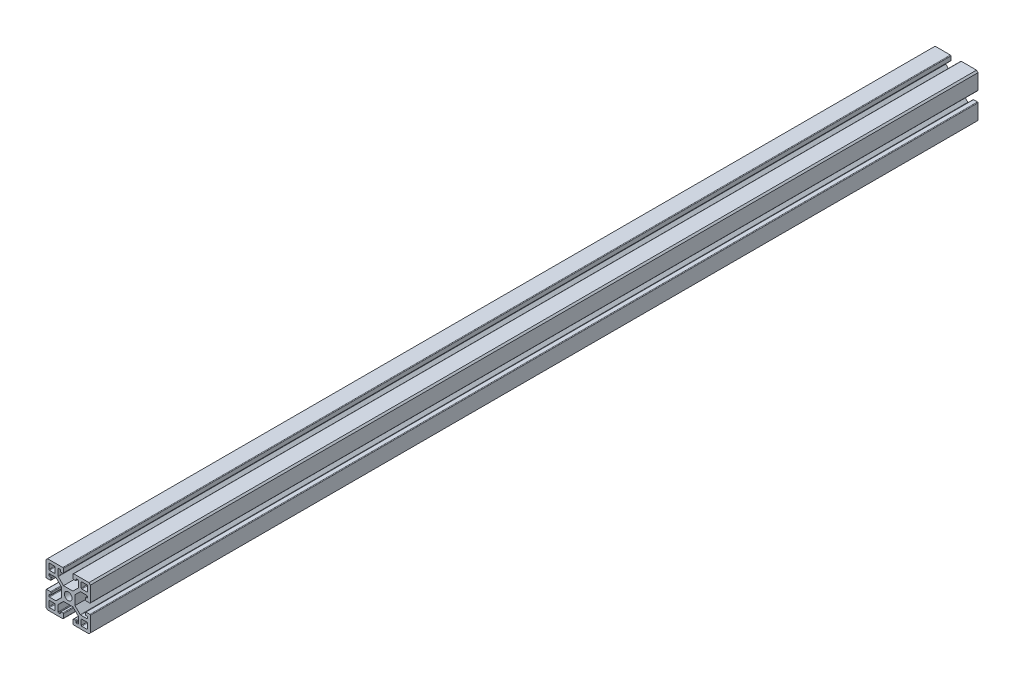
from build123d import *

# Parameters (mm, degrees)
SKETCH1_R      = 3.302
EXTRUDE1_DEPTH = 762


with BuildPart() as part:
    # Sketch1 → Extrude1 (new body)
    with BuildSketch(Plane.XY):
        with BuildLine():
            Line((4.699, 19.05), (17.78, 19.05))
            Line((17.78, 19.05), (19.05, 17.78))
            Line((19.05, 17.78), (19.05, 4.699))
            ThreePointArc((19.05, 4.699), (18.901210245, 4.339789755), (18.542, 4.191))
            Line((18.542, 4.191), (15.24, 4.191))
            ThreePointArc((15.24, 4.191), (14.880789755, 4.339789755), (14.732, 4.699))
            Line((14.732, 4.699), (14.732, 6.223))
            ThreePointArc((14.732, 6.223), (14.880789755, 6.582210245), (15.24, 6.731))
            Line((15.24, 6.731), (16.002, 6.731))
            ThreePointArc((16.002, 6.731), (16.361210245, 6.879789755), (16.51, 7.239))
            Line((16.51, 7.239), (16.51, 8.1534))
            ThreePointArc((16.51, 8.1534), (16.361210245, 8.512610245), (16.002, 8.6614))
            Line((16.002, 8.6614), (10.667871762, 8.6614))
            ThreePointArc((10.667871762, 8.6614), (10.473468578, 8.622730803), (10.308661517, 8.512610245))
            Line((10.308661517, 8.512610245), (5.842, 4.045948728))
            Line((5.842, 4.045948728), (5.842, -4.045948728))
            Line((5.842, -4.045948728), (10.308661517, -8.512610245))
            ThreePointArc((10.308661517, -8.512610245), (10.473468578, -8.622730803), (10.667871762, -8.6614))
            Line((10.667871762, -8.6614), (16.002, -8.6614))
            ThreePointArc((16.002, -8.6614), (16.361210245, -8.512610245), (16.51, -8.1534))
            Line((16.51, -8.1534), (16.51, -7.239))
            ThreePointArc((16.51, -7.239), (16.361210245, -6.879789755), (16.002, -6.731))
            Line((16.002, -6.731), (15.24, -6.731))
            ThreePointArc((15.24, -6.731), (14.880789755, -6.582210245), (14.732, -6.223))
            Line((14.732, -6.223), (14.732, -4.699))
            ThreePointArc((14.732, -4.699), (14.880789755, -4.339789755), (15.24, -4.191))
            Line((15.24, -4.191), (18.542, -4.191))
            ThreePointArc((18.542, -4.191), (18.901210245, -4.339789755), (19.05, -4.699))
            Line((19.05, -4.699), (19.05, -17.78))
            Line((19.05, -17.78), (17.78, -19.05))
            Line((17.78, -19.05), (4.699, -19.05))
            ThreePointArc((4.699, -19.05), (4.339789755, -18.901210245), (4.191, -18.542))
            Line((4.191, -18.542), (4.191, -15.24))
            ThreePointArc((4.191, -15.24), (4.339789755, -14.880789755), (4.699, -14.732))
            Line((4.699, -14.732), (6.223, -14.732))
            ThreePointArc((6.223, -14.732), (6.582210245, -14.880789755), (6.731, -15.24))
            Line((6.731, -15.24), (6.731, -16.002))
            ThreePointArc((6.731, -16.002), (6.879789755, -16.361210245), (7.239, -16.51))
            Line((7.239, -16.51), (8.1534, -16.51))
            ThreePointArc((8.1534, -16.51), (8.512610245, -16.361210245), (8.6614, -16.002))
            Line((8.6614, -16.002), (8.6614, -10.667871762))
            ThreePointArc((8.6614, -10.667871762), (8.622730803, -10.473468578), (8.512610245, -10.308661517))
            Line((8.512610245, -10.308661517), (4.045948728, -5.842))
            Line((4.045948728, -5.842), (-4.045948728, -5.842))
            Line((-4.045948728, -5.842), (-8.512610245, -10.308661517))
            ThreePointArc((-8.512610245, -10.308661517), (-8.622730803, -10.473468578), (-8.6614, -10.667871762))
            Line((-8.6614, -10.667871762), (-8.6614, -16.002))
            ThreePointArc((-8.6614, -16.002), (-8.512610245, -16.361210245), (-8.1534, -16.51))
            Line((-8.1534, -16.51), (-7.239, -16.51))
            ThreePointArc((-7.239, -16.51), (-6.879789755, -16.361210245), (-6.731, -16.002))
            Line((-6.731, -16.002), (-6.731, -15.24))
            ThreePointArc((-6.731, -15.24), (-6.582210245, -14.880789755), (-6.223, -14.732))
            Line((-6.223, -14.732), (-4.699, -14.732))
            ThreePointArc((-4.699, -14.732), (-4.339789755, -14.880789755), (-4.191, -15.24))
            Line((-4.191, -15.24), (-4.191, -18.542))
            ThreePointArc((-4.191, -18.542), (-4.339789755, -18.901210245), (-4.699, -19.05))
            Line((-4.699, -19.05), (-17.78, -19.05))
            Line((-17.78, -19.05), (-19.05, -17.78))
            Line((-19.05, -17.78), (-19.05, -4.699))
            ThreePointArc((-19.05, -4.699), (-18.901210245, -4.339789755), (-18.542, -4.191))
            Line((-18.542, -4.191), (-15.24, -4.191))
            ThreePointArc((-15.24, -4.191), (-14.880789755, -4.339789755), (-14.732, -4.699))
            Line((-14.732, -4.699), (-14.732, -6.223))
            ThreePointArc((-14.732, -6.223), (-14.880789755, -6.582210245), (-15.24, -6.731))
            Line((-15.24, -6.731), (-16.002, -6.731))
            ThreePointArc((-16.002, -6.731), (-16.361210245, -6.879789755), (-16.51, -7.239))
            Line((-16.51, -7.239), (-16.51, -8.1534))
            ThreePointArc((-16.51, -8.1534), (-16.361210245, -8.512610245), (-16.002, -8.6614))
            Line((-16.002, -8.6614), (-10.667871762, -8.6614))
            ThreePointArc((-10.667871762, -8.6614), (-10.473468578, -8.622730803), (-10.308661517, -8.512610245))
            Line((-10.308661517, -8.512610245), (-5.842, -4.045948728))
            Line((-5.842, -4.045948728), (-5.842, 4.045948728))
            Line((-5.842, 4.045948728), (-10.308661517, 8.512610245))
            ThreePointArc((-10.308661517, 8.512610245), (-10.473468578, 8.622730803), (-10.667871762, 8.6614))
            Line((-10.667871762, 8.6614), (-16.002, 8.6614))
            ThreePointArc((-16.002, 8.6614), (-16.361210245, 8.512610245), (-16.51, 8.1534))
            Line((-16.51, 8.1534), (-16.51, 7.239))
            ThreePointArc((-16.51, 7.239), (-16.361210245, 6.879789755), (-16.002, 6.731))
            Line((-16.002, 6.731), (-15.24, 6.731))
            ThreePointArc((-15.24, 6.731), (-14.880789755, 6.582210245), (-14.732, 6.223))
            Line((-14.732, 6.223), (-14.732, 4.699))
            ThreePointArc((-14.732, 4.699), (-14.880789755, 4.339789755), (-15.24, 4.191))
            Line((-15.24, 4.191), (-18.542, 4.191))
            ThreePointArc((-18.542, 4.191), (-18.901210245, 4.339789755), (-19.05, 4.699))
            Line((-19.05, 4.699), (-19.05, 17.78))
            Line((-19.05, 17.78), (-17.78, 19.05))
            Line((-17.78, 19.05), (-4.699, 19.05))
            ThreePointArc((-4.699, 19.05), (-4.339789755, 18.901210245), (-4.191, 18.542))
            Line((-4.191, 18.542), (-4.191, 15.24))
            ThreePointArc((-4.191, 15.24), (-4.339789755, 14.880789755), (-4.699, 14.732))
            Line((-4.699, 14.732), (-6.223, 14.732))
            ThreePointArc((-6.223, 14.732), (-6.582210245, 14.880789755), (-6.731, 15.24))
            Line((-6.731, 15.24), (-6.731, 16.002))
            ThreePointArc((-6.731, 16.002), (-6.879789755, 16.361210245), (-7.239, 16.51))
            Line((-7.239, 16.51), (-8.1534, 16.51))
            ThreePointArc((-8.1534, 16.51), (-8.512610245, 16.361210245), (-8.6614, 16.002))
            Line((-8.6614, 16.002), (-8.6614, 10.667871762))
            ThreePointArc((-8.6614, 10.667871762), (-8.622730803, 10.473468578), (-8.512610245, 10.308661517))
            Line((-8.512610245, 10.308661517), (-4.045948728, 5.842))
            Line((-4.045948728, 5.842), (4.045948728, 5.842))
            Line((4.045948728, 5.842), (8.512610245, 10.308661517))
            ThreePointArc((8.512610245, 10.308661517), (8.622730803, 10.473468578), (8.6614, 10.667871762))
            Line((8.6614, 10.667871762), (8.6614, 16.002))
            ThreePointArc((8.6614, 16.002), (8.512610245, 16.361210245), (8.1534, 16.51))
            Line((8.1534, 16.51), (7.239, 16.51))
            ThreePointArc((7.239, 16.51), (6.879789755, 16.361210245), (6.731, 16.002))
            Line((6.731, 16.002), (6.731, 15.24))
            ThreePointArc((6.731, 15.24), (6.582210245, 14.880789755), (6.223, 14.732))
            Line((6.223, 14.732), (4.699, 14.732))
            ThreePointArc((4.699, 14.732), (4.339789755, 14.880789755), (4.191, 15.24))
            Line((4.191, 15.24), (4.191, 18.542))
            ThreePointArc((4.191, 18.542), (4.339789755, 18.901210245), (4.699, 19.05))
        make_face()
        Circle(SKETCH1_R, mode=Mode.SUBTRACT)
        with BuildLine():
            Line((11.2014, 16.002), (11.2014, 11.7094))
            ThreePointArc((11.2014, 11.7094), (11.350189755, 11.350189755), (11.7094, 11.2014))
            Line((11.7094, 11.2014), (16.002, 11.2014))
            ThreePointArc((16.002, 11.2014), (16.361210245, 11.350189755), (16.51, 11.7094))
            Line((16.51, 11.7094), (16.51, 16.002))
            ThreePointArc((16.51, 16.002), (16.361210245, 16.361210245), (16.002, 16.51))
            Line((16.002, 16.51), (11.7094, 16.51))
            ThreePointArc((11.7094, 16.51), (11.350189755, 16.361210245), (11.2014, 16.002))
        make_face(mode=Mode.SUBTRACT)
        with BuildLine():
            Line((-16.002, 11.2014), (-11.7094, 11.2014))
            ThreePointArc((-11.7094, 11.2014), (-11.350189755, 11.350189755), (-11.2014, 11.7094))
            Line((-11.2014, 11.7094), (-11.2014, 16.002))
            ThreePointArc((-11.2014, 16.002), (-11.350189755, 16.361210245), (-11.7094, 16.51))
            Line((-11.7094, 16.51), (-16.002, 16.51))
            ThreePointArc((-16.002, 16.51), (-16.361210245, 16.361210245), (-16.51, 16.002))
            Line((-16.51, 16.002), (-16.51, 11.7094))
            ThreePointArc((-16.51, 11.7094), (-16.361210245, 11.350189755), (-16.002, 11.2014))
        make_face(mode=Mode.SUBTRACT)
        with BuildLine():
            Line((-11.2014, -16.002), (-11.2014, -11.7094))
            ThreePointArc((-11.2014, -11.7094), (-11.350189755, -11.350189755), (-11.7094, -11.2014))
            Line((-11.7094, -11.2014), (-16.002, -11.2014))
            ThreePointArc((-16.002, -11.2014), (-16.361210245, -11.350189755), (-16.51, -11.7094))
            Line((-16.51, -11.7094), (-16.51, -16.002))
            ThreePointArc((-16.51, -16.002), (-16.361210245, -16.361210245), (-16.002, -16.51))
            Line((-16.002, -16.51), (-11.7094, -16.51))
            ThreePointArc((-11.7094, -16.51), (-11.350189755, -16.361210245), (-11.2014, -16.002))
        make_face(mode=Mode.SUBTRACT)
        with BuildLine():
            Line((16.002, -11.2014), (11.7094, -11.2014))
            ThreePointArc((11.7094, -11.2014), (11.350189755, -11.350189755), (11.2014, -11.7094))
            Line((11.2014, -11.7094), (11.2014, -16.002))
            ThreePointArc((11.2014, -16.002), (11.350189755, -16.361210245), (11.7094, -16.51))
            Line((11.7094, -16.51), (16.002, -16.51))
            ThreePointArc((16.002, -16.51), (16.361210245, -16.361210245), (16.51, -16.002))
            Line((16.51, -16.002), (16.51, -11.7094))
            ThreePointArc((16.51, -11.7094), (16.361210245, -11.350189755), (16.002, -11.2014))
        make_face(mode=Mode.SUBTRACT)
    extrude(amount=EXTRUDE1_DEPTH)


solid = part.part
